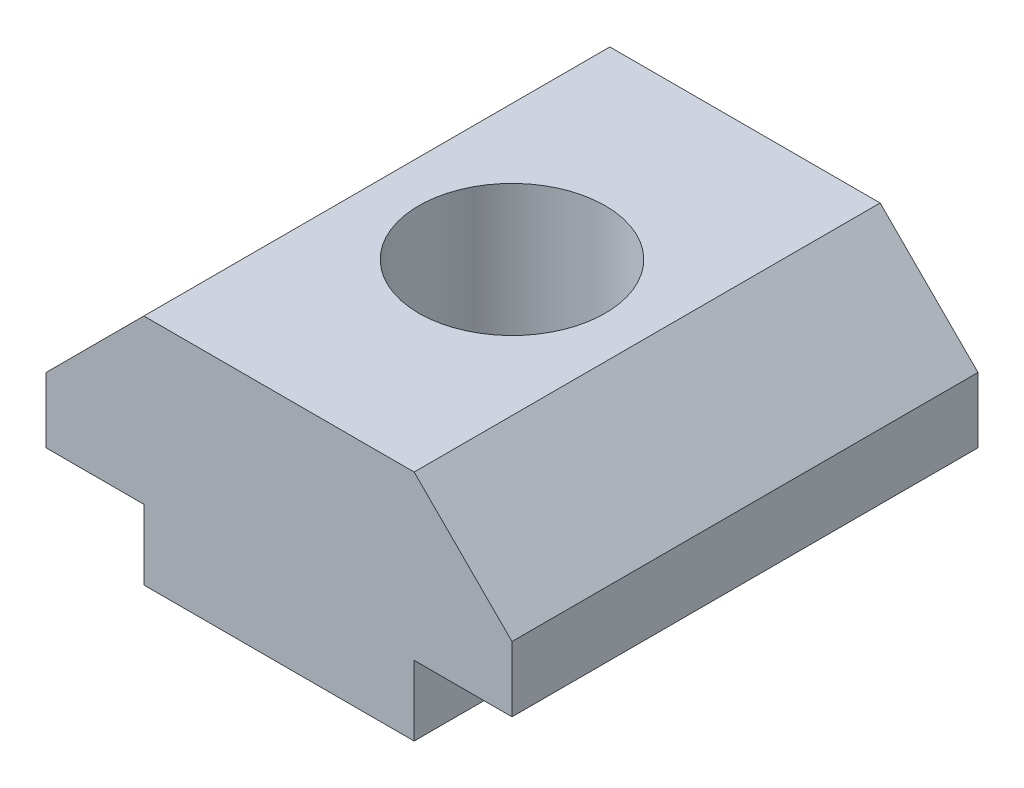
from build123d import *

# Parameters (mm, degrees)
EXTRUDE_1_DEPTH     = 10
SKETCH_4_R          = 2
CUT_EXTRUDE_1_DEPTH = 13.247448714


with BuildPart() as part:
    # 草图1 → 凸台-拉伸1 (new body)
    with BuildSketch(Plane.XY):
        Polygon((-2.9, 0), (2.9, 0), (2.9, 1.5), (5, 1.5), (5, 2.9), (2.9, 5), (-2.9, 5), (-5, 2.9), (-5, 1.5), (-2.9, 1.5), align=None)
    extrude(amount=-EXTRUDE_1_DEPTH)

    # 草图4 → 切除-拉伸1 (cut, through all)
    with BuildSketch(Plane(origin=(0, 5, 0), x_dir=(1, 0, 0), z_dir=(0, 1, 0))):
        with Locations(Location((0, 5, 0), (0, 0, 270))):
            Circle(SKETCH_4_R)
    extrude(amount=-CUT_EXTRUDE_1_DEPTH, mode=Mode.SUBTRACT)


solid = part.part
